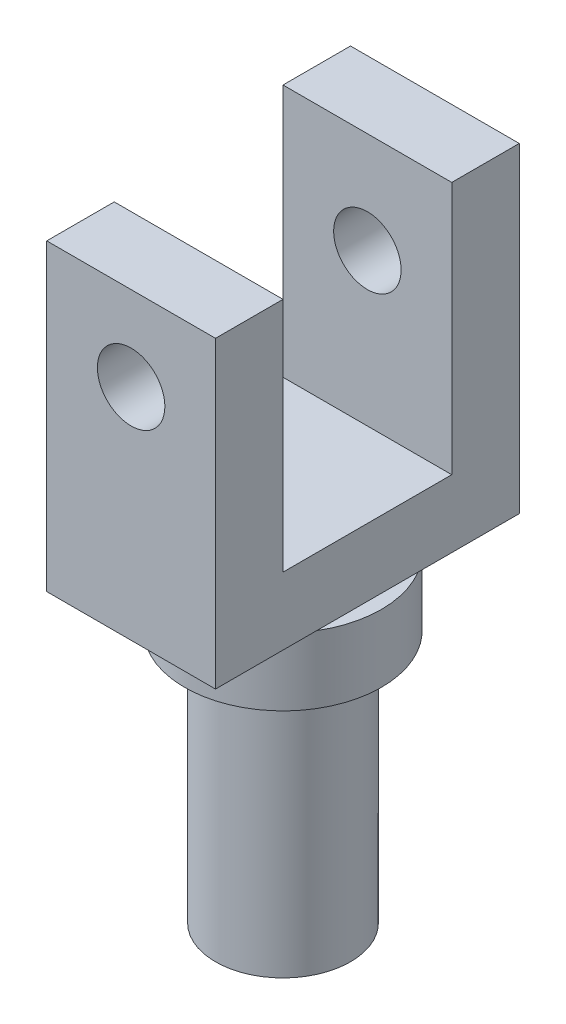
from build123d import *

# Parameters (mm, degrees)
ESQUISSE1_W             = 50
ESQUISSE1_H             = 70
ESQUISSE1_R             = 10
BOSS_EXTRU_1_DEPTH      = 20
ESQUISSE2_W             = 50
ESQUISSE2_H             = 90
BOSS_EXTRU_2_DEPTH      = 20
ESQUISSE3_R             = 29.154759474
BOSS_EXTRU_3_DEPTH      = 20
ESQUISSE4_R             = 20
BOSS_EXTRU_4_DEPTH      = 75
ESQUISSE5_W             = 50
ESQUISSE5_H             = 20
BOSS_EXTRU_5_DEPTH      = 75
ESQUISSE6_R             = 10
ENL_V_MAT_EXTRU_1_DEPTH = 75


with BuildPart() as part:
    # Esquisse1 → Boss.-Extru.1 (new body)
    with BuildSketch(Plane.XY):
        with Locations((-270.845240526, -10)):
            Rectangle(ESQUISSE1_W, ESQUISSE1_H)
        with Locations((-270.845240526, 0)):
            Circle(ESQUISSE1_R, mode=Mode.SUBTRACT)
    extrude(amount=BOSS_EXTRU_1_DEPTH)

    # Esquisse2 → Boss.-Extru.2 (add)
    with BuildSketch(Plane.XZ.offset(45)):
        with Locations((-270.845240526, -25)):
            Rectangle(ESQUISSE2_W, ESQUISSE2_H)
    extrude(amount=BOSS_EXTRU_2_DEPTH)

    # Esquisse3 → Boss.-Extru.3 (add)
    with BuildSketch(Plane.XZ.offset(65)):
        with Locations(Location((-270.845240526, -25, 0), (0, 0, 30.963756532))):
            Circle(ESQUISSE3_R)
    extrude(amount=BOSS_EXTRU_3_DEPTH)

    # Esquisse4 → Boss.-Extru.4 (add)
    with BuildSketch(Plane.XZ.offset(85)):
        with Locations(Location((-270.845240526, -25, 0), (0, 0, 270))):
            Circle(ESQUISSE4_R)
    extrude(amount=BOSS_EXTRU_4_DEPTH)

    # Esquisse5 → Boss.-Extru.5 (add)
    with BuildSketch(Plane(origin=(0, -45, 0), x_dir=(1, 0, 0), z_dir=(0, 1, 0))):
        with Locations((-270.845240526, 60)):
            Rectangle(ESQUISSE5_W, ESQUISSE5_H)
    extrude(amount=BOSS_EXTRU_5_DEPTH)

    # Esquisse6 → Enlèv. mat.-Extru.1 (cut)
    with BuildSketch(Plane(origin=(0, 0, -70), x_dir=(-1, 0, 0), z_dir=(0, 0, -1))):
        with Locations(Location((270.845240526, 0, 0), (0, 0, 180))):
            Circle(ESQUISSE6_R)
    extrude(amount=-ENL_V_MAT_EXTRU_1_DEPTH, mode=Mode.SUBTRACT)


solid = part.part
